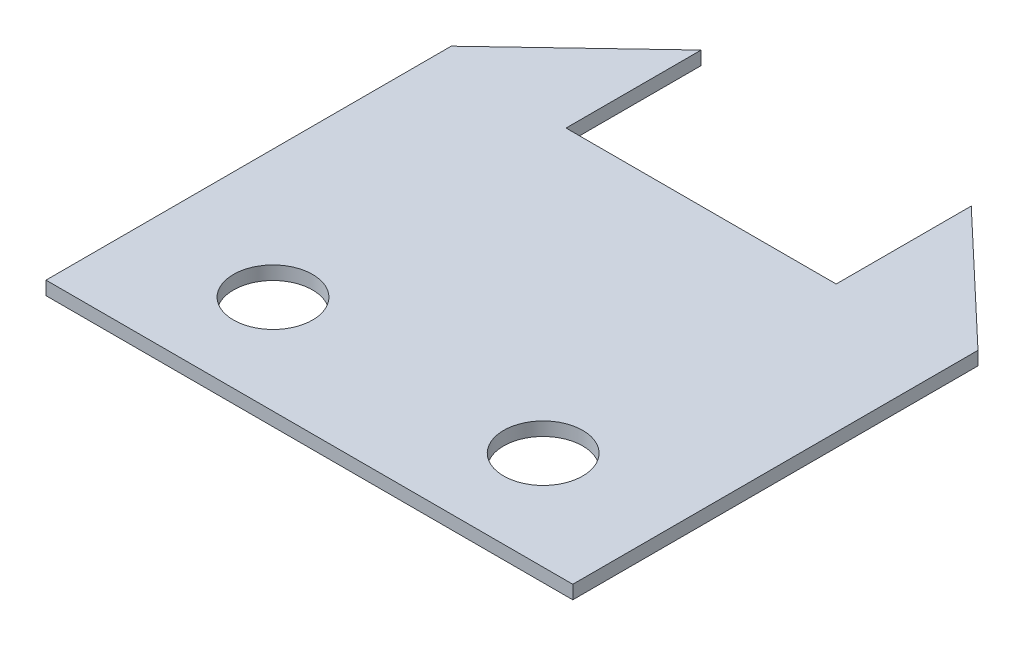
from build123d import *

# Parameters (mm, degrees)
ESBO_O1_R                = 5.857023813
RESSALTO_EXTRUS_O1_DEPTH = 2


with BuildPart() as part:
    # Esboço1 → Ressalto-extrusão1 (new body)
    with BuildSketch(Plane(origin=(0, 0, 0), x_dir=(1, 0, 0), z_dir=(0, 1, 0))):
        Polygon((-20, 48), (-39, 30), (-39, -30), (39, -30), (39, 30), (20, 48), (20, 28), (-20, 28), align=None)
        with Locations(Location((-20, -15.384615385, 0), (0, 0, 270))):
            Circle(ESBO_O1_R, mode=Mode.SUBTRACT)
        with Locations(Location((20, -15.384615385, 0), (0, 0, 90))):
            Circle(ESBO_O1_R, mode=Mode.SUBTRACT)
    extrude(amount=RESSALTO_EXTRUS_O1_DEPTH)


solid = part.part
